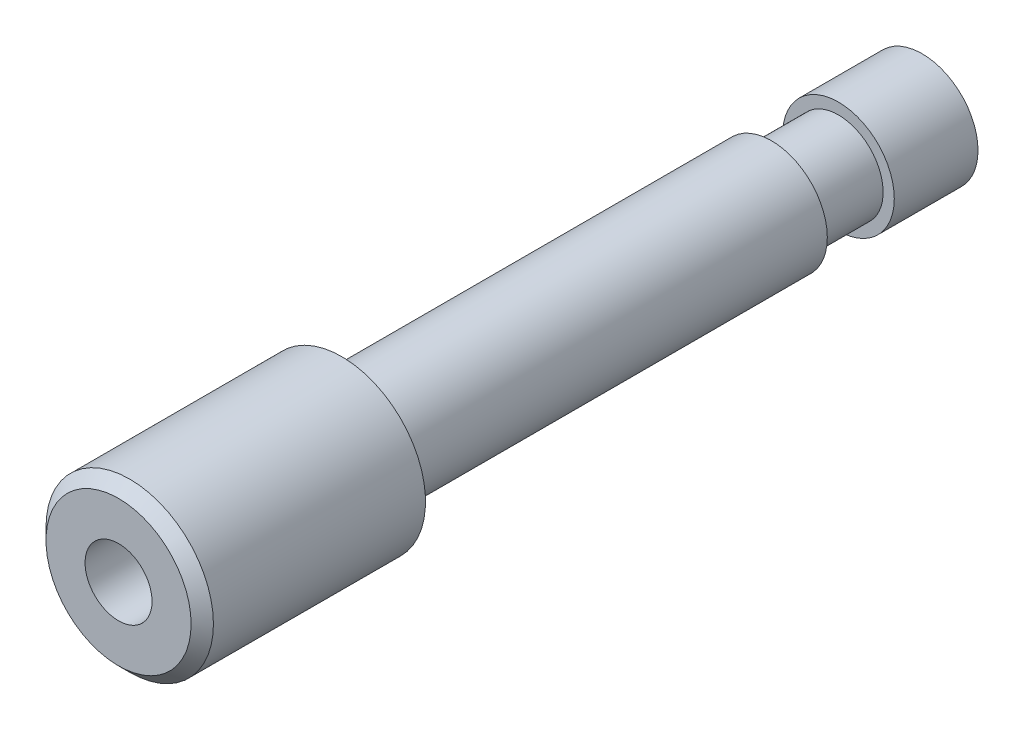
from build123d import *

# Parameters (mm, degrees)
ESQUISSE1_R             = 3.75
EXTRUSION1_DEPTH        = 25.5
ESQUISSE2_R             = 2.5
EXTRUSION2_DEPTH        = 10.5
ESQUISSE3_R             = 1.5
ENL_V_MAT_EXTRU_1_DEPTH = 8
ESQUISSE5_W             = 3.097754454
ESQUISSE5_H             = 3
ESQUISSE6_W             = 5.14619883
ESQUISSE6_H             = 0.986249407
ENL_V_MAT_EXTRU_3_DEPTH = 2
ESQUISSE8_OUTSIDE_W     = 17.006
ESQUISSE8_OUTSIDE_H     = 17.006
ESQUISSE8_OUTSIDE_R     = 2.5
EXTRUSION5_DEPTH        = 15.5
CHANFREIN1_SIZE         = 0.5


with BuildPart() as part:
    # Esquisse1 → Extrusion1 (new body)
    with BuildSketch(Plane.XY):
        Circle(ESQUISSE1_R)
    extrude(amount=EXTRUSION1_DEPTH)

    # Esquisse2 → Extrusion2 (add)
    with BuildSketch(Plane(origin=(0, 0, 0), x_dir=(-1, 0, 0), z_dir=(0, 0, -1))):
        with Locations(Location((0, 0, 0), (0, 0, 180))):
            Circle(ESQUISSE2_R)
    extrude(amount=EXTRUSION2_DEPTH)

    # Esquisse3 → Enlèv. mat.-Extru.1 (cut)
    with BuildSketch(Plane.XY.offset(25.5)):
        Circle(ESQUISSE3_R)
    extrude(amount=-ENL_V_MAT_EXTRU_1_DEPTH, mode=Mode.SUBTRACT)

    # Esquisse5 → Enlèvement de matière-Révolution1 (revolve, cut)
    with BuildSketch(Plane(origin=(0, 0, 0), x_dir=(1, 0, 0), z_dir=(0, 1, 0))):
        with Locations((3.548877227, 5.25)):
            Rectangle(ESQUISSE5_W, ESQUISSE5_H)
    revolve(axis=Axis((0, 0, -10.5), (0, 0, 1)), mode=Mode.SUBTRACT)

    # Esquisse6 → Enlèv. mat.-Extru.3 (cut)
    with BuildSketch(Plane(origin=(0, 0, -10.5), x_dir=(-1, 0, 0), z_dir=(0, 0, -1))):
        with Locations((0.031610558, -2.493124704)):
            Rectangle(ESQUISSE6_W, ESQUISSE6_H)
    extrude(amount=-ENL_V_MAT_EXTRU_3_DEPTH, mode=Mode.SUBTRACT)

    # Esquisse8 outside → Extrusion5 (cut)
    with BuildSketch(Plane(origin=(0, 0, 0), x_dir=(-1, 0, 0), z_dir=(0, 0, -1))):
        Rectangle(ESQUISSE8_OUTSIDE_W, ESQUISSE8_OUTSIDE_H)
        with Locations(Location((0, 0, 0), (0, 0, 180))):
            Circle(ESQUISSE8_OUTSIDE_R, mode=Mode.SUBTRACT)
    extrude(amount=-EXTRUSION5_DEPTH, mode=Mode.SUBTRACT)

    # Chanfrein1
    chanfrein1_edges = [part.edges().sort_by_distance(p)[0] for p in [
        (-3.75, 0, 25.5),
    ]]
    chamfer(chanfrein1_edges, length=CHANFREIN1_SIZE)


solid = part.part
